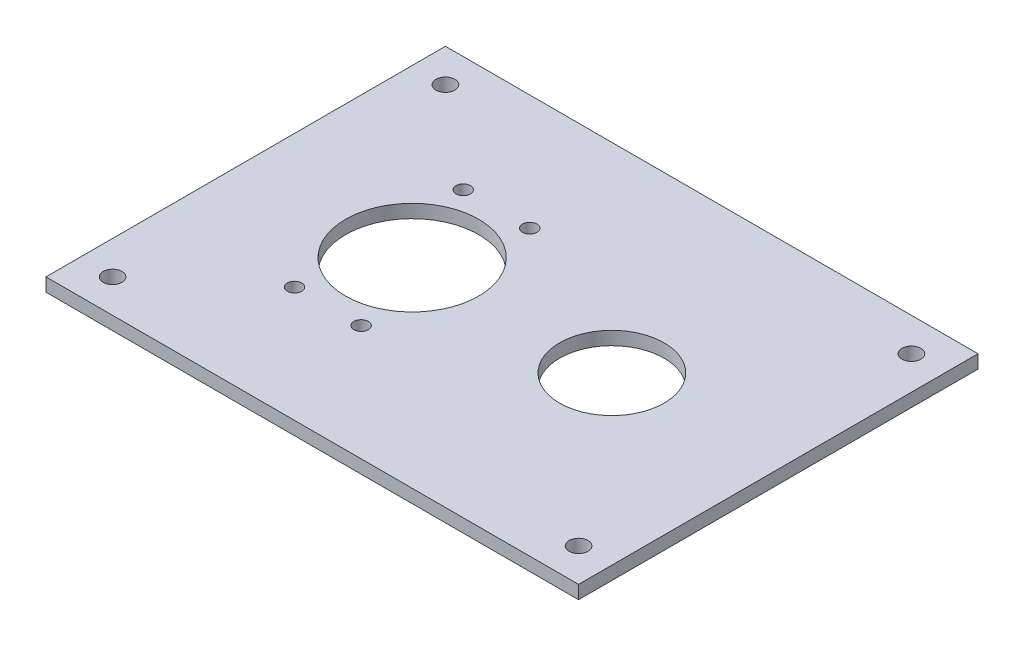
from build123d import *

# Parameters (mm, degrees)
SKETCH1_W           = 240
SKETCH1_H           = 180
SKETCH1_R           = 23.55
SKETCH1_R_2         = 30
SKETCH1_R_3         = 4.25
SKETCH1_R_4         = 3.25
PLATE_EXTRUDE_DEPTH = 6


with BuildPart() as part:
    # Sketch1 → Plate_Extrude (new body)
    with BuildSketch(Plane(origin=(0, 0, 0), x_dir=(1, 0, 0), z_dir=(0, 1, 0))):
        Rectangle(SKETCH1_W, SKETCH1_H)
        with Locations(Location((45, 0, 0), (0, 0, 270))):
            Circle(SKETCH1_R, mode=Mode.SUBTRACT)
        with Locations(Location((-45, 0, 0), (0, 0, 270))):
            Circle(SKETCH1_R_2, mode=Mode.SUBTRACT)
        with Locations(Location((-105, -75, 0), (0, 0, 270))):
            Circle(SKETCH1_R_3, mode=Mode.SUBTRACT)
        with Locations(Location((105, -75, 0), (0, 0, 270))):
            Circle(SKETCH1_R_3, mode=Mode.SUBTRACT)
        with Locations(Location((-105, 75, 0), (0, 0, 270))):
            Circle(SKETCH1_R_3, mode=Mode.SUBTRACT)
        with Locations(Location((105, 75, 0), (0, 0, 270))):
            Circle(SKETCH1_R_3, mode=Mode.SUBTRACT)
        with Locations(Location((-60, -38, 0), (0, 0, 270))):
            Circle(SKETCH1_R_4, mode=Mode.SUBTRACT)
        with Locations(Location((-60, 38, 0), (0, 0, 270))):
            Circle(SKETCH1_R_4, mode=Mode.SUBTRACT)
        with Locations(Location((-30, -38, 0), (0, 0, 270))):
            Circle(SKETCH1_R_4, mode=Mode.SUBTRACT)
        with Locations(Location((-30, 38, 0), (0, 0, 270))):
            Circle(SKETCH1_R_4, mode=Mode.SUBTRACT)
    extrude(amount=PLATE_EXTRUDE_DEPTH)


solid = part.part
